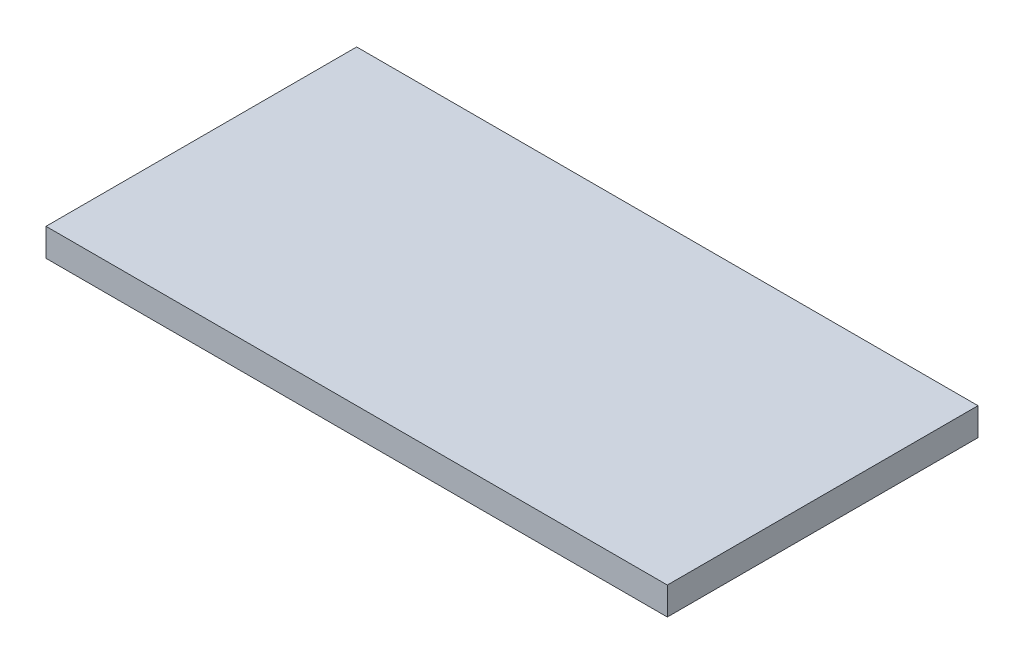
from build123d import *

# Parameters (mm, degrees)
SKETCH1_W           = 35.56
SKETCH1_H           = 17.78
BOSS_EXTRUDE1_DEPTH = 1.5875


with BuildPart() as part:
    # Sketch1 → Boss-Extrude1 (new body)
    with BuildSketch(Plane(origin=(0, 0, 0), x_dir=(1, 0, 0), z_dir=(0, 1, 0))):
        with Locations((17.78, 8.89)):
            Rectangle(SKETCH1_W, SKETCH1_H)
    extrude(amount=BOSS_EXTRUDE1_DEPTH)


solid = part.part
